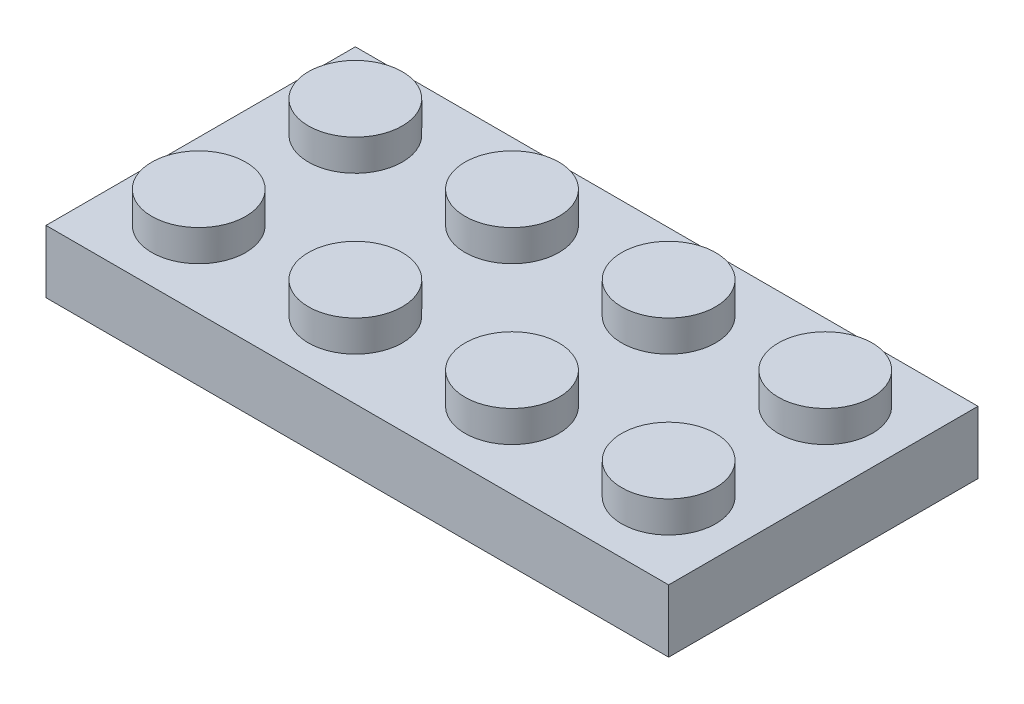
from build123d import *

# Parameters (mm, degrees)
MAINBASESKETCH_W             = 31.8
MAINBASESKETCH_H             = 3.2
MAINBASEEXTRUDE_DEPTH        = 7.9
STUDSSKETCH_R                = 2.4
STUDSEXTRUDE_DEPTH           = 1.6
STUDSPATTERN_COUNT           = 2
STUDSPATTERN_PITCH           = 8
STUDSPATTERN_COUNT_DIR2      = 4
STUDSPATTERN_PITCH_DIR2      = 8
MAINBASESHELL_T              = -1.2
UNDERSIDECIRCLEEXT_START     = -0.2
UNDERSIDECIRCLESKETCH_R      = 3.14
UNDERSIDECIRCLESKETCH_R_2    = 2.4
UNDERSIDECIRCLEEXT_DEPTH     = 1.6
UNDERSIDECIRCLEPATTERN_COUNT = 3
UNDERSIDECIRCLEPATTERN_PITCH = 8


with BuildPart() as part:
    # MainBaseSketch → MainBaseExtrude (new, symmetric)
    with BuildSketch(Plane.XY):
        with Locations((16.581967213, 1.6)):
            Rectangle(MAINBASESKETCH_W, MAINBASESKETCH_H)
    extrude(amount=MAINBASEEXTRUDE_DEPTH, both=True)

    # StudsSketch → StudsExtrude (add)
    with BuildSketch(Plane(origin=(0, 3.2, 0), x_dir=(1, 0, 0), z_dir=(0, 1, 0))):
        with Locations((4.581967213, 4)):
            Circle(STUDSSKETCH_R)
    studsextrude = extrude(amount=STUDSEXTRUDE_DEPTH)

    # StudsPattern: StudsExtrude 2 × 4
    with Locations(*[(j * STUDSPATTERN_PITCH_DIR2, 0, i * STUDSPATTERN_PITCH) for i in range(STUDSPATTERN_COUNT) for j in range(STUDSPATTERN_COUNT_DIR2) if (i, j) != (0, 0)]):
        add(studsextrude)

    # MainBaseShell
    mainbaseshell_openings = [part.faces().sort_by_distance(p)[0] for p in [
        (16.581967213, 0, 0),
    ]]
    offset(amount=MAINBASESHELL_T, openings=mainbaseshell_openings, kind=Kind.INTERSECTION)

    # UnderSideCircleSketch → UnderSideCircleExt (add)
    with BuildSketch(Plane.XZ.offset(-2).offset(UNDERSIDECIRCLEEXT_START)):
        with Locations((8.581967213, 0)):
            Circle(UNDERSIDECIRCLESKETCH_R)
        with Locations((8.581967213, 0)):
            Circle(UNDERSIDECIRCLESKETCH_R_2, mode=Mode.SUBTRACT)
    undersidecircleext = extrude(amount=UNDERSIDECIRCLEEXT_DEPTH)

    # UnderSideCirclePattern: UnderSideCircleExt ×3
    with Locations(*[(i * UNDERSIDECIRCLEPATTERN_PITCH, 0, 0) for i in range(1, UNDERSIDECIRCLEPATTERN_COUNT)]):
        add(undersidecircleext)


solid = part.part
